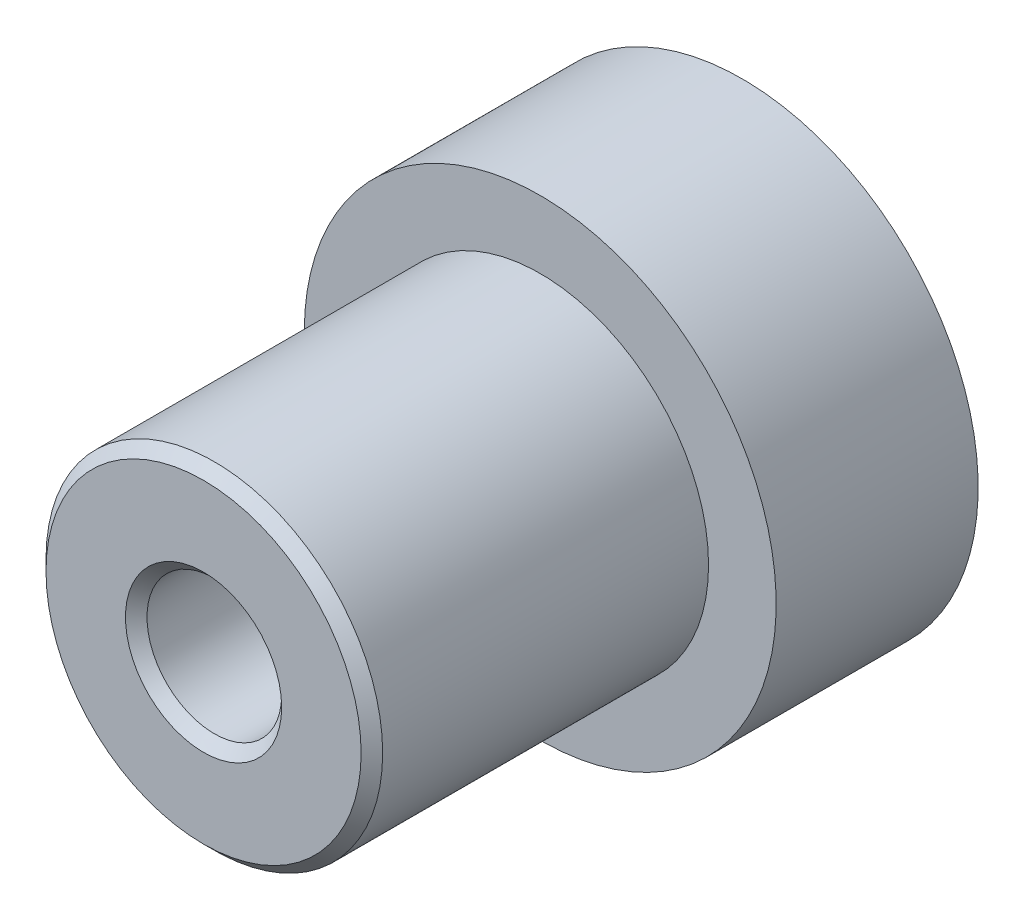
from build123d import *

# Parameters (mm, degrees)
SKETCH1_R           = 5.5626
BOSS_EXTRUDE1_DEPTH = 4.7625
SKETCH2_R           = 3.96875
BOSS_EXTRUDE2_DEPTH = 7.9375
SKETCH3_R           = 1.5875
CUT_EXTRUDE1_DEPTH  = 15.939044063
CHAMFER1_SIZE       = 0.254


with BuildPart() as part:
    # Sketch1 → Boss-Extrude1 (new body)
    with BuildSketch(Plane.XY):
        with Locations(Location((0, 0, 0), (0, 0, 180))):
            Circle(SKETCH1_R)
    extrude(amount=BOSS_EXTRUDE1_DEPTH)

    # Sketch2 → Boss-Extrude2 (add)
    with BuildSketch(Plane.XY.offset(4.7625)):
        Circle(SKETCH2_R)
    extrude(amount=BOSS_EXTRUDE2_DEPTH)

    # Sketch3 → Cut-Extrude1 (cut, through all)
    with BuildSketch(Plane(origin=(0, 0, 0), x_dir=(-1, 0, 0), z_dir=(0, 0, -1))):
        Circle(SKETCH3_R)
    extrude(amount=-CUT_EXTRUDE1_DEPTH, mode=Mode.SUBTRACT)

    # Chamfer1
    chamfer1_edges = [part.edges().sort_by_distance(p)[0] for p in [
        (1.5875, 0, 12.7),
        (1.5875, 0, 0),
        (-3.96875, 0, 12.7),
    ]]
    chamfer(chamfer1_edges, length=CHAMFER1_SIZE)


solid = part.part
